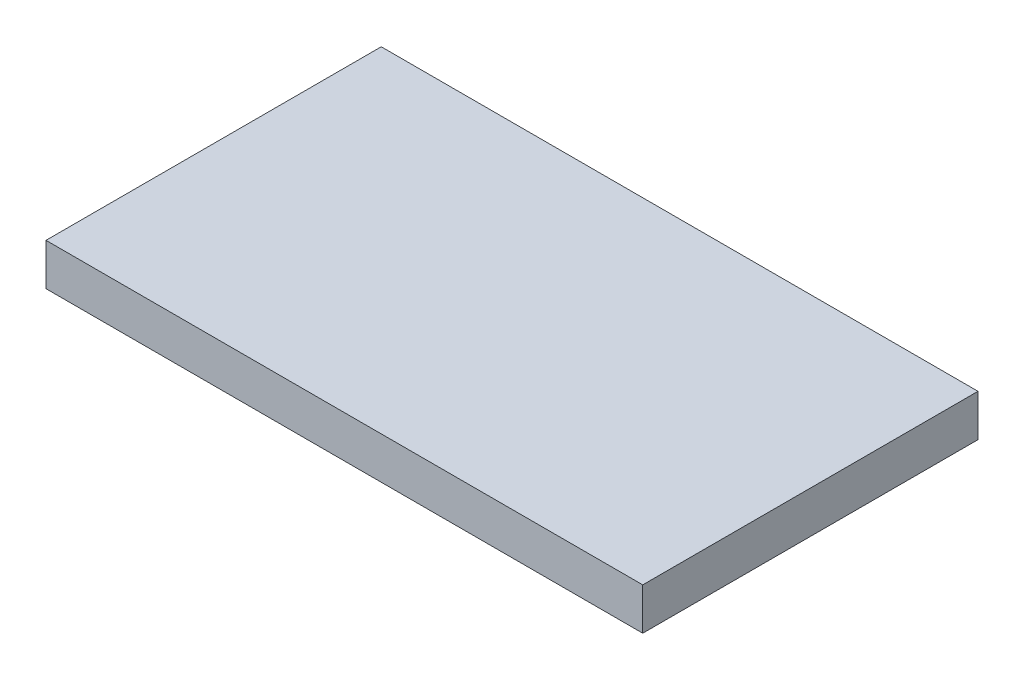
from build123d import *

# Parameters (mm, degrees)
SKETCH1_W           = 17.8
SKETCH1_H           = 10
BOSS_EXTRUDE1_DEPTH = 1.25


with BuildPart() as part:
    # Sketch1 → Boss-Extrude1 (new body)
    with BuildSketch(Plane(origin=(0, 0, 0), x_dir=(1, 0, 0), z_dir=(0, 1, 0))):
        Rectangle(SKETCH1_W, SKETCH1_H)
    extrude(amount=BOSS_EXTRUDE1_DEPTH)


solid = part.part
